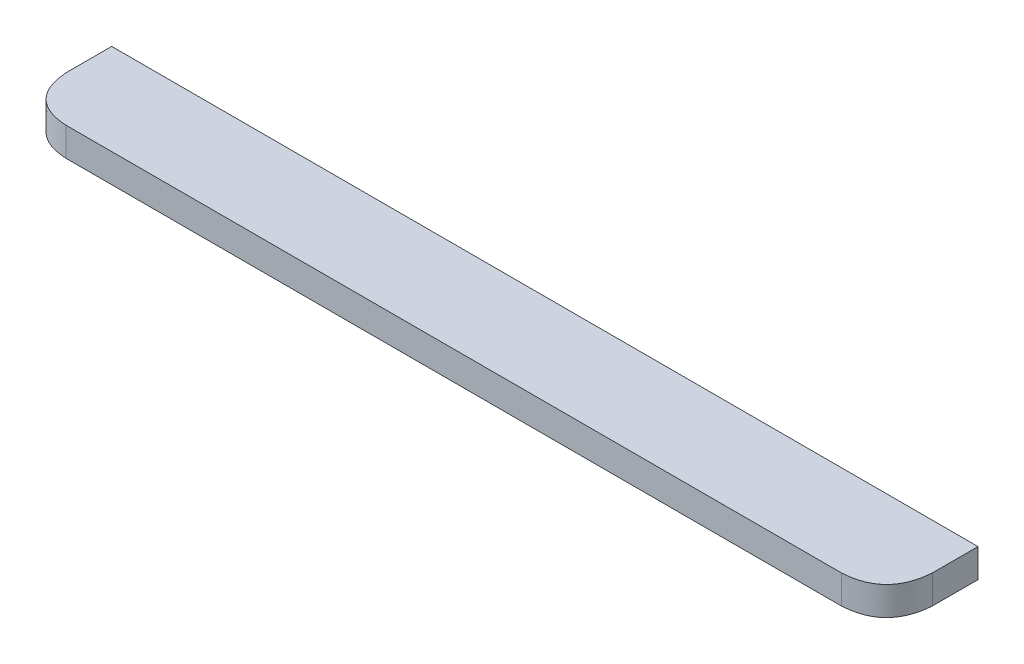
from build123d import *

# Parameters (mm, degrees)
BOSS_EXTRUDE1_DEPTH = 8


with BuildPart() as part:
    # Sketch2 → Boss-Extrude1 (new body)
    with BuildSketch(Plane(origin=(0, 0, 0), x_dir=(1, 0, 0), z_dir=(0, 1, 0))):
        with BuildLine():
            Line((-108.077, -25.034226815), (108.077, -25.034226815))
            add(Edge.make_bspline(
                [(108.077, -25.034226815), (119.922774985, -24.424634346), (120.777, -12.334226815)],
                knots=[0, 0, 0, 1, 1, 1], degree=2))
            Line((120.777, -12.334226815), (120.777, 0.365773185))
            Line((120.777, 0.365773185), (-120.777, 0.365773185))
            Line((-120.777, 0.365773185), (-120.777, -12.334226815))
            add(Edge.make_bspline(
                [(-108.077, -25.034226815), (-119.922774985, -24.424634346), (-120.777, -12.334226815)],
                knots=[0, 0, 0, 1, 1, 1], degree=2))
        make_face()
    extrude(amount=BOSS_EXTRUDE1_DEPTH)


solid = part.part
